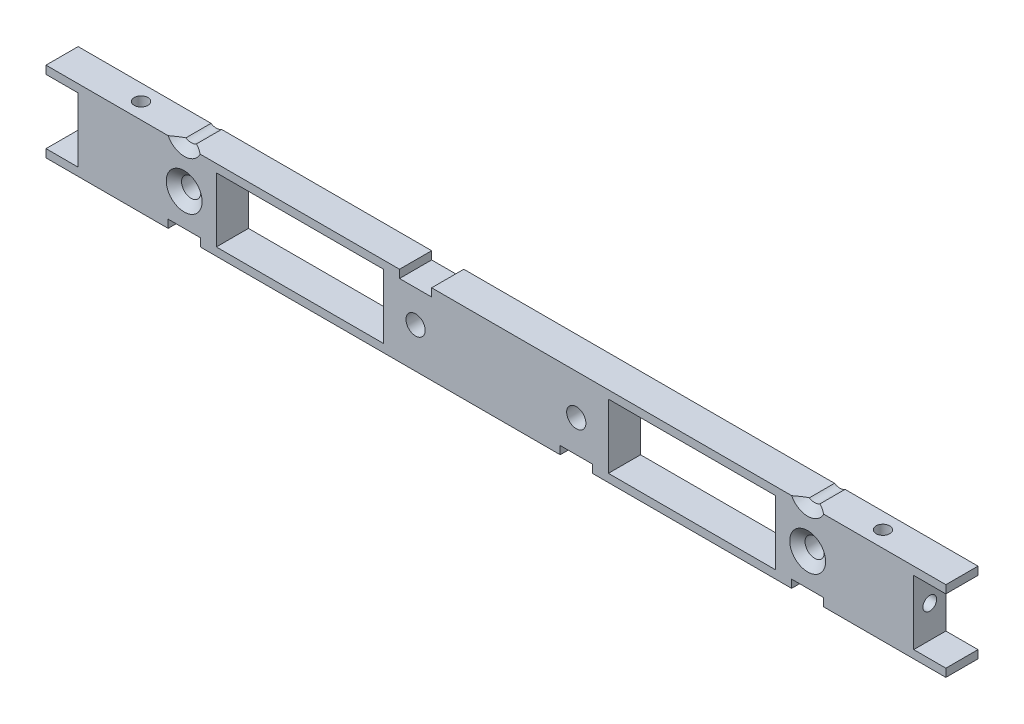
from build123d import *

# Parameters (mm, degrees)
BOSS_EXTRUDE1_DEPTH                               = 6.35
SKETCH7_W                                         = 6.35
SKETCH7_H                                         = 1.5875
CUT_EXTRUDE1_DEPTH                                = 91.02678768
SKETCH10_W                                        = 6.35
SKETCH10_H                                        = 1.5875
SKETCH10_W_2                                      = 33.02
SKETCH10_H_2                                      = 12.7
CUT_EXTRUDE5_DEPTH                                = 91.02678768
CSK_FOR_6_FLAT_HEAD_MACHINE_SCREW_100_D           = 3.7973
CSK_FOR_6_FLAT_HEAD_MACHINE_SCREW_100_CSINK_D     = 7.0866
CSK_FOR_6_FLAT_HEAD_MACHINE_SCREW_100_CSINK_ANGLE = 100
CSK_FOR_6_FLAT_HEAD_MACHINE_SCREW_2_D             = 3.7973
CSK_FOR_6_FLAT_HEAD_MACHINE_SCREW_2_CSINK_D       = 7.0866
CSK_FOR_6_FLAT_HEAD_MACHINE_SCREW_2_CSINK_ANGLE   = 100


with BuildPart() as part:
    # Sketch1 → Boss-Extrude1 (new body)
    with BuildSketch(Plane.XY):
        Polygon((-88.9, 3.175), (88.9, 3.175), (88.9, 1.5875), (82.55, 1.5875), (82.55, -11.1125), (88.9, -11.1125), (88.9, -12.7), (-88.9, -12.7), (-88.9, -11.1125), (-82.55, -11.1125), (-82.55, 1.5875), (-88.9, 1.5875), align=None)
    extrude(amount=BOSS_EXTRUDE1_DEPTH)

    # Sketch4 → Tap Drill for #6-32 Tap1 (revolve, cut)
    with BuildSketch(Plane(origin=(-82.55, -4.7625, 3.175), x_dir=(0, 0, 1), z_dir=(0, 1, 0))):
        Polygon((0, 0), (0, 13.51269403), (1.35255, 12.7), (1.35255, 0), align=None)
    tap_drill_for_6_32_tap1 = revolve(axis=Axis((-88.9, -4.7625, 3.175), (1, 0, 0)), mode=Mode.SUBTRACT)

    # Mirror1: Tap Drill for #6-32 Tap1 across plane
    add(tap_drill_for_6_32_tap1.mirror(Plane(origin=(0, 0, 0), x_dir=(0, 0, 1), z_dir=(1, 0, 0))), mode=Mode.SUBTRACT)

    # Sketch5 → Tap Drill for #6-32 Tap2 (revolve, cut)
    with BuildSketch(Plane(origin=(-73.289583418, 3.175, 3.175), x_dir=(0, 0, 1), z_dir=(1, 0, 0))):
        Polygon((0, 0), (0, 7.16269403), (1.35255, 6.35), (1.35255, 0), align=None)
    tap_drill_for_6_32_tap2 = revolve(axis=Axis((-73.289583418, 9.525, 3.175), (0, -1, 0)), mode=Mode.SUBTRACT)

    # Mirror2: Tap Drill for #6-32 Tap2 across plane
    add(tap_drill_for_6_32_tap2.mirror(Plane(origin=(0, 0, 0), x_dir=(0, 0, 1), z_dir=(1, 0, 0))), mode=Mode.SUBTRACT)

    # Mirror3: Tap Drill for #6-32 Tap2 across plane
    add(tap_drill_for_6_32_tap2.mirror(Plane(origin=(0, -4.7625, 0), x_dir=(0, 0, 1), z_dir=(0, -1, 0))), mode=Mode.SUBTRACT)

    # Mirror3 copy 1 sketch → Mirror3 copy 1 (revolve, cut)
    with BuildSketch(Plane(origin=(73.289583418, -12.7, 3.175), x_dir=(0, 0, 1), z_dir=(-1, 0, 0))):
        Polygon((0, 0), (0, 7.16269403), (1.35255, 6.35), (1.35255, 0), align=None)
    revolve(axis=Axis((73.289583418, -19.05, 3.175), (0, 1, 0)), mode=Mode.SUBTRACT)

    # Sketch7 → Cut-Extrude1 (cut, through all)
    with BuildSketch(Plane.XY.offset(6.35)):
        with Locations((-61.595, 11.90625)):
            Rectangle(SKETCH7_W, SKETCH7_H)
        with Locations((-61.595, -11.90625)):
            Rectangle(SKETCH7_W, SKETCH7_H)
        with Locations((61.595, -11.90625)):
            Rectangle(SKETCH7_W, SKETCH7_H)
        with Locations((61.595, 11.90625)):
            Rectangle(SKETCH7_W, SKETCH7_H)
    extrude(amount=-CUT_EXTRUDE1_DEPTH, mode=Mode.SUBTRACT)

    # Sketch10 → Cut-Extrude5 (cut, through all)
    with BuildSketch(Plane(origin=(0, 0, 0), x_dir=(-1, 0, 0), z_dir=(0, 0, -1))):
        with Locations((-15.875, 11.90625)):
            Rectangle(SKETCH10_W, SKETCH10_H)
        with Locations((15.875, 2.38125)):
            Rectangle(SKETCH10_W, SKETCH10_H)
        with Locations((-15.875, -11.90625)):
            Rectangle(SKETCH10_W, SKETCH10_H)
        with Locations((15.875, -21.43125)):
            Rectangle(SKETCH10_W, SKETCH10_H)
        with Locations((-38.735, -4.7625)):
            Rectangle(SKETCH10_W_2, SKETCH10_H_2)
        with Locations((38.735, -4.7625)):
            Rectangle(SKETCH10_W_2, SKETCH10_H_2)
    extrude(amount=-CUT_EXTRUDE5_DEPTH, mode=Mode.SUBTRACT)

    # CSK for _6 Flat Head Machine Screw _100 (through all)
    with Locations(Plane.XY.offset(6.35)):
        with Locations((-61.595, 4.7625), (-61.595, -4.7625)):
            csk_for_6_flat_head_machine_screw_100 = CounterSinkHole(CSK_FOR_6_FLAT_HEAD_MACHINE_SCREW_100_D / 2, CSK_FOR_6_FLAT_HEAD_MACHINE_SCREW_100_CSINK_D / 2, counter_sink_angle=CSK_FOR_6_FLAT_HEAD_MACHINE_SCREW_100_CSINK_ANGLE)

    # CSK for _6 Flat Head Machine Screw _ 2 (through all)
    with Locations(Plane(origin=(0, 0, 0), x_dir=(-1, 0, 0), z_dir=(0, 0, -1))):
        with Locations((15.875, -4.7625)):
            csk_for_6_flat_head_machine_screw_2 = CounterSinkHole(CSK_FOR_6_FLAT_HEAD_MACHINE_SCREW_2_D / 2, CSK_FOR_6_FLAT_HEAD_MACHINE_SCREW_2_CSINK_D / 2, counter_sink_angle=CSK_FOR_6_FLAT_HEAD_MACHINE_SCREW_2_CSINK_ANGLE)

    # Mirror5: CSK for _6 Flat Head Machine Screw _100, CSK for _6 Flat Head Machine Screw _ 2 across plane
    add(csk_for_6_flat_head_machine_screw_100.mirror(Plane(origin=(0, 0, 0), x_dir=(0, 0, 1), z_dir=(1, 0, 0))), mode=Mode.SUBTRACT)
    add(csk_for_6_flat_head_machine_screw_2.mirror(Plane(origin=(0, 0, 0), x_dir=(0, 0, 1), z_dir=(1, 0, 0))), mode=Mode.SUBTRACT)


solid = part.part
